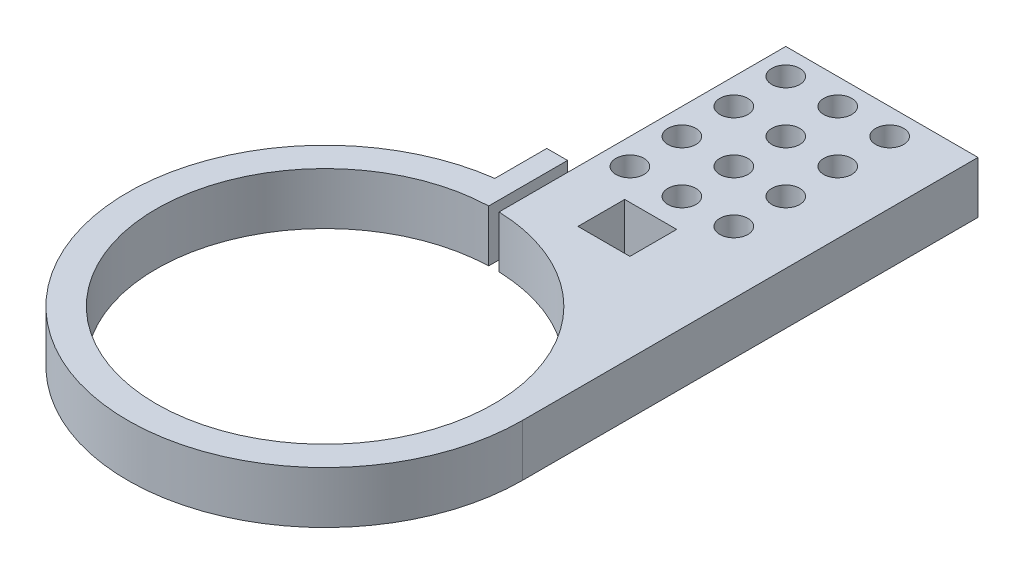
from build123d import *

# Parameters (mm, degrees)
SKETCH1_R           = 48.26
SKETCH1_R_2         = 41.275
BOSS_EXTRUDE1_DEPTH = 12.7
SKETCH2_W           = 12.7
SKETCH2_H           = 12.7
BOSS_EXTRUDE2_DEPTH = 12.7
SKETCH4_W           = 2.54
SKETCH4_H           = 44.098902666
CUT_EXTRUDE2_DEPTH  = 79.456734484
BOSS_EXTRUDE3_REACH = 128.717
BOSS_EXTRUDE3_START = 48.26
SKETCH5_W           = 60.540412833
SKETCH5_H           = 12.7
SKETCH6_W           = 46.99
SKETCH6_H           = 50.8
BOSS_EXTRUDE4_DEPTH = 12.7
SKETCH7_R           = 3.429
SKETCH7_W           = 12.7
SKETCH7_H           = 11.43
CUT_EXTRUDE3_DEPTH  = 123.012315484


with BuildPart() as part:
    # Sketch1 → Boss-Extrude1 (new body)
    with BuildSketch(Plane(origin=(0, 0, 0), x_dir=(1, 0, 0), z_dir=(0, 1, 0))):
        with Locations(Location((0, 0, 0), (0, 0, 270))):
            Circle(SKETCH1_R)
        with Locations(Location((0, 0, 0), (0, 0, 270))):
            Circle(SKETCH1_R_2, mode=Mode.SUBTRACT)
    extrude(amount=BOSS_EXTRUDE1_DEPTH)

    # Sketch2 → Boss-Extrude2 (add)
    with BuildSketch(Plane(origin=(0, 0, 0), x_dir=(1, 0, 0), z_dir=(0, 1, 0))):
        with Locations((0, 54.190412833)):
            Rectangle(SKETCH2_W, SKETCH2_H)
    extrude(amount=BOSS_EXTRUDE2_DEPTH)

    # Sketch4 → Cut-Extrude2 (cut, through all)
    with BuildSketch(Plane(origin=(0, 0, 0), x_dir=(1, 0, 0), z_dir=(0, 1, 0))):
        with Locations((0, 60.121342859)):
            Rectangle(SKETCH4_W, SKETCH4_H)
    extrude(amount=CUT_EXTRUDE2_DEPTH, mode=Mode.SUBTRACT)

    # Sketch5 → Boss-Extrude3 (add, up to next)
    with BuildSketch(Plane(origin=(0, 0, 0), x_dir=(0, 0, -1), z_dir=(1, 0, 0)).offset(BOSS_EXTRUDE3_START), mode=Mode.PRIVATE) as boss_extrude3_sk1:
        with Locations((30.270206417, 6.35)):
            Rectangle(SKETCH5_W, SKETCH5_H)
    boss_extrude3_tool1 = extrude(boss_extrude3_sk1.sketch, amount=-BOSS_EXTRUDE3_REACH, mode=Mode.PRIVATE) - part.part
    add(boss_extrude3_tool1.solids().sort_by_distance((48.26, 6.35, -30.270206))[0])

    # Sketch6 → Boss-Extrude4 (add)
    with BuildSketch(Plane(origin=(0, 12.7, 0), x_dir=(1, 0, 0), z_dir=(0, 1, 0))):
        with Locations((24.765, 85.940412833)):
            Rectangle(SKETCH6_W, SKETCH6_H)
    extrude(amount=-BOSS_EXTRUDE4_DEPTH)

    # Sketch7 → Cut-Extrude3 (cut, through all)
    with BuildSketch(Plane(origin=(0, 0, 0), x_dir=(1, 0, 0), z_dir=(0, 1, 0))):
        with Locations(Location((7.62, 104.990412833, 0), (0, 0, 270))):
            Circle(SKETCH7_R)
        with Locations(Location((20.32, 104.990412833, 0), (0, 0, 270))):
            Circle(SKETCH7_R)
        with Locations(Location((20.32, 92.290412833, 0), (0, 0, 270))):
            Circle(SKETCH7_R)
        with Locations(Location((7.62, 92.290412833, 0), (0, 0, 270))):
            Circle(SKETCH7_R)
        with Locations(Location((7.62, 79.590412833, 0), (0, 0, 270))):
            Circle(SKETCH7_R)
        with Locations(Location((20.32, 79.590412833, 0), (0, 0, 270))):
            Circle(SKETCH7_R)
        with Locations(Location((7.62, 66.890412833, 0), (0, 0, 270))):
            Circle(SKETCH7_R)
        with Locations(Location((20.32, 66.890412833, 0), (0, 0, 270))):
            Circle(SKETCH7_R)
        with Locations(Location((33.02, 104.990412833, 0), (0, 0, 270))):
            Circle(SKETCH7_R)
        with Locations(Location((33.02, 92.290412833, 0), (0, 0, 270))):
            Circle(SKETCH7_R)
        with Locations(Location((33.02, 79.590412833, 0), (0, 0, 270))):
            Circle(SKETCH7_R)
        with Locations(Location((33.02, 66.890412833, 0), (0, 0, 270))):
            Circle(SKETCH7_R)
        with Locations((20.32, 53.555412833)):
            Rectangle(SKETCH7_W, SKETCH7_H)
    extrude(amount=CUT_EXTRUDE3_DEPTH, mode=Mode.SUBTRACT)


solid = part.part
